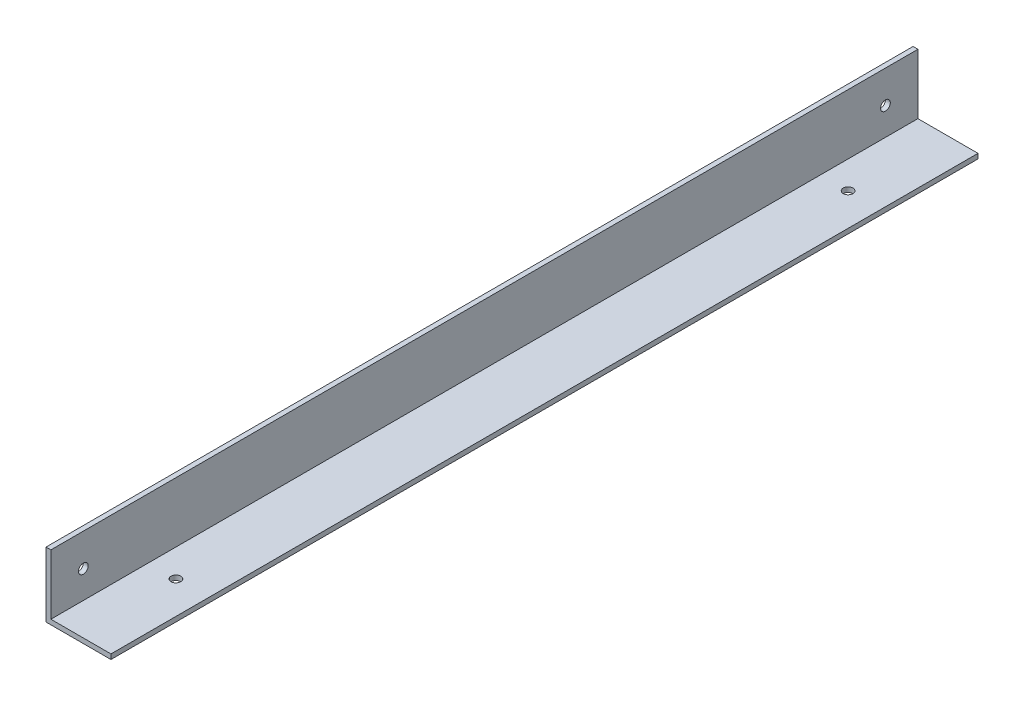
from build123d import *

# Parameters (mm, degrees)
EXTRUSION1_DEPTH = 267
ESQUISSE2_R      = 1.5
EXTRUSION2_DEPTH = 269.38638192
ESQUISSE3_R      = 1.5
EXTRUSION3_DEPTH = 264


with BuildPart() as part:
    # Esquisse1 → Extrusion1 (new body)
    with BuildSketch(Plane.XY):
        Polygon((0, 0), (20, 0), (20, 1.5), (1.5, 1.5), (1.5, 20), (0, 20), align=None)
    extrude(amount=EXTRUSION1_DEPTH)

    # Esquisse2 → Extrusion2 (cut, through all)
    with BuildSketch(Plane(origin=(0, 1.5, 0), x_dir=(1, 0, 0), z_dir=(0, 1, 0))):
        with Locations(Location((10, -30, 0), (0, 0, 180))):
            Circle(ESQUISSE2_R)
        with Locations(Location((10, -237, 0), (0, 0, 180))):
            Circle(ESQUISSE2_R)
    extrude(amount=-EXTRUSION2_DEPTH, mode=Mode.SUBTRACT)

    # Esquisse3 → Extrusion3 (cut)
    with BuildSketch(Plane(origin=(1.5, 0, 0), x_dir=(0, 0, -1), z_dir=(1, 0, 0))):
        with Locations(Location((-257, 10, 0), (0, 0, 90))):
            Circle(ESQUISSE3_R)
        with Locations(Location((-10, 10, 0), (0, 0, 90))):
            Circle(ESQUISSE3_R)
    extrude(amount=-EXTRUSION3_DEPTH, mode=Mode.SUBTRACT)


solid = part.part
